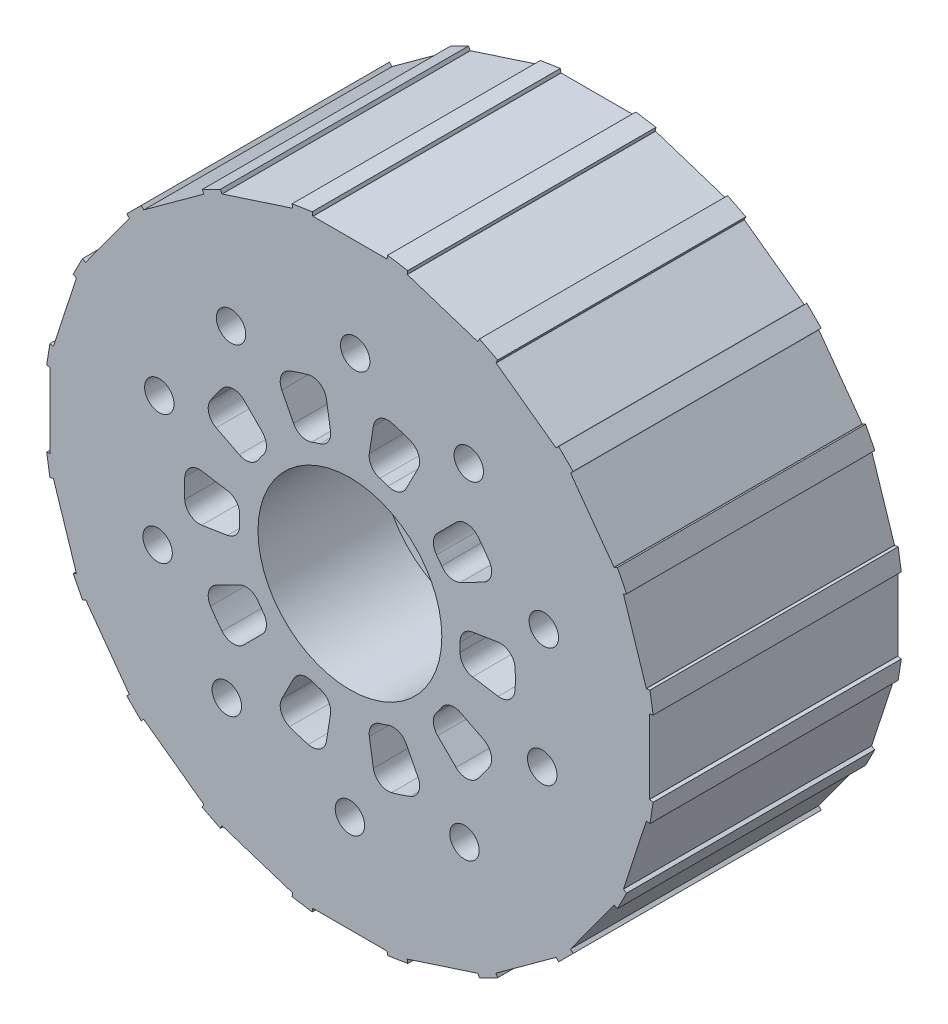
from build123d import *

# Parameters (mm, degrees)
SKETCH1_R           = 25
BOSS_EXTRUDE1_DEPTH = 67.5
SKETCH2_R           = 68
CUT_EXTRUDE1_DEPTH  = 33.75
SKETCH3_R           = 4
CUT_EXTRUDE2_DEPTH  = 33.75
CUT_EXTRUDE3_DEPTH  = 33.75
SKETCH5_R           = 4
CUT_EXTRUDE4_DEPTH  = 122.418033578


with BuildPart() as part:
    # Sketch1 → Boss-Extrude1 (new body)
    with BuildSketch(Plane.XY):
        Polygon((10, 81.5), (-10, 81.5), (-10.098768834, 81.484356553), (-10.255203299, 82.472044894), (-15.73198551, 81.604607809), (-15.575551045, 80.616919468), (-15.674319879, 80.601276022), (-34.695450205, 74.420936134), (-34.784550857, 74.375537084), (-35.238541357, 75.266543609), (-40.179217965, 72.749143139), (-39.725227466, 71.858136614), (-39.814328118, 71.812737564), (-55.994668006, 60.057032519), (-56.065378684, 59.986321841), (-56.772485465, 60.693428622), (-60.693428622, 56.772485465), (-59.986321841, 56.065378684), (-60.057032519, 55.994668006), (-71.812737564, 39.814328118), (-71.858136614, 39.725227466), (-72.749143139, 40.179217965), (-75.266543609, 35.238541357), (-74.375537084, 34.784550857), (-74.420936134, 34.695450205), (-80.601276022, 15.674319879), (-80.616919468, 15.575551045), (-81.604607809, 15.73198551), (-82.472044894, 10.255203299), (-81.484356553, 10.098768834), (-81.5, 10), (-81.5, -10), (-81.484356553, -10.098768834), (-82.472044894, -10.255203299), (-81.604607809, -15.73198551), (-80.616919468, -15.575551045), (-80.601276022, -15.674319879), (-74.420936134, -34.695450205), (-74.375537084, -34.784550857), (-75.266543609, -35.238541357), (-72.749143139, -40.179217965), (-71.858136614, -39.725227466), (-71.812737564, -39.814328118), (-60.057032519, -55.994668006), (-59.986321841, -56.065378684), (-60.693428622, -56.772485465), (-56.772485465, -60.693428622), (-56.065378684, -59.986321841), (-55.994668006, -60.057032519), (-39.814328118, -71.812737564), (-39.725227466, -71.858136614), (-40.179217965, -72.749143139), (-35.238541357, -75.266543609), (-34.784550857, -74.375537084), (-34.695450205, -74.420936134), (-15.674319879, -80.601276022), (-15.575551045, -80.616919468), (-15.73198551, -81.604607809), (-10.255203299, -82.472044894), (-10.098768834, -81.484356553), (-10, -81.5), (10, -81.5), (10.098768834, -81.484356553), (10.255203299, -82.472044894), (15.73198551, -81.604607809), (15.575551045, -80.616919468), (15.674319879, -80.601276022), (34.695450205, -74.420936134), (34.784550857, -74.375537084), (35.238541357, -75.266543609), (40.179217965, -72.749143139), (39.725227466, -71.858136614), (39.814328118, -71.812737564), (55.994668006, -60.057032519), (56.065378684, -59.986321841), (56.772485465, -60.693428622), (60.693428622, -56.772485465), (59.986321841, -56.065378684), (60.057032519, -55.994668006), (71.812737564, -39.814328118), (71.858136614, -39.725227466), (72.749143139, -40.179217965), (75.266543609, -35.238541357), (74.375537084, -34.784550857), (74.420936134, -34.695450205), (80.601276022, -15.674319879), (80.616919468, -15.575551045), (81.604607809, -15.73198551), (82.472044894, -10.255203299), (81.484356554, -10.098768834), (81.5, -10), (81.5, 10), (81.484356553, 10.098768834), (82.472044894, 10.255203299), (81.604607809, 15.73198551), (80.616919468, 15.575551045), (80.601276022, 15.674319879), (74.420936134, 34.695450205), (74.375537084, 34.784550857), (75.266543609, 35.238541357), (72.749143139, 40.179217965), (71.858136614, 39.725227466), (71.812737564, 39.814328118), (60.057032519, 55.994668006), (59.986321841, 56.065378684), (60.693428622, 56.772485465), (56.772485465, 60.693428622), (56.065378684, 59.986321841), (55.994668006, 60.057032519), (39.814328118, 71.812737564), (39.725227466, 71.858136614), (40.179217965, 72.749143139), (35.238541357, 75.266543609), (34.784550857, 74.375537084), (34.695450205, 74.420936134), (15.674319879, 80.601276022), (15.575551045, 80.616919468), (15.73198551, 81.604607809), (10.255203299, 82.472044894), (10.098768834, 81.484356553), align=None)
        Circle(SKETCH1_R, mode=Mode.SUBTRACT)
    extrude(amount=BOSS_EXTRUDE1_DEPTH)

    # Sketch2 → Cut-Extrude1 (cut)
    with BuildSketch(Plane(origin=(0, 0, 0), x_dir=(-1, 0, 0), z_dir=(0, 0, -1))):
        Circle(SKETCH2_R)
    extrude(amount=-CUT_EXTRUDE1_DEPTH, mode=Mode.SUBTRACT)

    # Sketch3 → Cut-Extrude2 (cut)
    with BuildSketch(Plane(origin=(0, 0, 33.75), x_dir=(-1, 0, 0), z_dir=(0, 0, -1))):
        with Locations((32.328188876, 44.495934691)):
            Circle(SKETCH3_R)
        with Locations((52.308108396, -16.995934691)):
            Circle(SKETCH3_R)
        with Locations((0, -55)):
            Circle(SKETCH3_R)
        with Locations((-52.308108396, -16.995934691)):
            Circle(SKETCH3_R)
        with Locations((-32.328188876, 44.495934691)):
            Circle(SKETCH3_R)
    extrude(amount=-CUT_EXTRUDE2_DEPTH, mode=Mode.SUBTRACT)

    # Sketch4 → Cut-Extrude3 (cut)
    with BuildSketch(Plane(origin=(0, 0, 33.75), x_dir=(-1, 0, 0), z_dir=(0, 0, -1))):
        with BuildLine():
            Line((-5.281835449, 33.348196567), (-6.383216288, 40.302041509))
            ThreePointArc((-6.383216288, 40.302041509), (-8.14367989, 43.023336778), (-11.342161812, 43.547162542))
            ThreePointArc((-11.342161812, 43.547162542), (-13.905764747, 42.797543233), (-16.420378262, 41.897149995))
            ThreePointArc((-16.420378262, 41.897149995), (-18.700107434, 39.593345547), (-18.52481518, 36.356996886))
            Line((-18.52481518, 36.356996886), (-15.328483493, 30.083842737))
            ThreePointArc((-15.328483493, 30.083842737), (-13.222545057, 28.175025497), (-10.380403585, 28.146886531))
            ThreePointArc((-10.380403585, 28.146886531), (-9.270509831, 28.531695489), (-8.146401893, 28.872757683))
            ThreePointArc((-8.146401893, 28.872757683), (-5.86360081, 30.566091427), (-5.281835449, 33.348196567))
        make_face()
        with BuildLine():
            Line((15.328483493, 30.083842737), (18.52481518, 36.356996886))
            ThreePointArc((18.52481518, 36.356996886), (18.700107434, 39.593345547), (16.420378262, 41.897149995))
            ThreePointArc((16.420378262, 41.897149995), (13.905764747, 42.797543233), (11.342161812, 43.547162542))
            ThreePointArc((11.342161812, 43.547162542), (8.14367989, 43.023336778), (6.383216288, 40.302041509))
            Line((6.383216288, 40.302041509), (5.281835449, 33.348196567))
            ThreePointArc((5.281835449, 33.348196567), (5.86360081, 30.566091427), (8.146401893, 28.872757683))
            ThreePointArc((8.146401893, 28.872757683), (9.270509831, 28.531695489), (10.380403585, 28.146886531))
            ThreePointArc((10.380403585, 28.146886531), (13.222545057, 28.175025497), (15.328483493, 30.083842737))
        make_face()
        with BuildLine():
            Line((30.083842737, 15.328483493), (36.356996886, 18.52481518))
            ThreePointArc((36.356996886, 18.52481518), (38.401089313, 21.040042045), (37.910891949, 24.243850182))
            ThreePointArc((37.910891949, 24.243850182), (36.405764747, 26.450336353), (34.77238158, 28.563639111))
            ThreePointArc((34.77238158, 28.563639111), (31.87685829, 30.019875669), (28.853076093, 28.853076093))
            Line((28.853076093, 28.853076093), (23.874672773, 23.874672773))
            ThreePointArc((23.874672773, 23.874672773), (22.710050465, 21.281949334), (23.561558733, 18.570216748))
            ThreePointArc((23.561558733, 18.570216748), (24.270509831, 17.633557569), (24.94224771, 16.669861403))
            ThreePointArc((24.94224771, 16.669861403), (27.25812813, 15.022057462), (30.083842737, 15.328483493))
        make_face()
        with BuildLine():
            Line((33.348196567, -5.281835449), (40.302041509, -6.383216288))
            ThreePointArc((40.302041509, -6.383216288), (43.434160278, -5.549842393), (44.920733454, -2.669776382))
            ThreePointArc((44.920733454, -2.669776382), (45, 0), (44.920733454, 2.669776382))
            ThreePointArc((44.920733454, 2.669776382), (43.434160278, 5.549842393), (40.302041509, 6.383216288))
            Line((40.302041509, 6.383216288), (33.348196567, 5.281835449))
            ThreePointArc((33.348196567, 5.281835449), (30.882032728, 3.868825943), (29.977000965, 1.174484194))
            ThreePointArc((29.977000965, 1.174484194), (30, 0), (29.977000965, -1.174484194))
            ThreePointArc((29.977000965, -1.174484194), (30.882032728, -3.868825943), (33.348196567, -5.281835449))
        make_face()
        with BuildLine():
            Line((23.874672773, -23.874672773), (28.853076093, -28.853076093))
            ThreePointArc((28.853076093, -28.853076093), (31.87685829, -30.019875669), (34.77238158, -28.563639111))
            ThreePointArc((34.77238158, -28.563639111), (36.405764747, -26.450336353), (37.910891949, -24.243850182))
            ThreePointArc((37.910891949, -24.243850182), (38.401089313, -21.040042045), (36.356996886, -18.52481518))
            Line((36.356996886, -18.52481518), (30.083842737, -15.328483493))
            ThreePointArc((30.083842737, -15.328483493), (27.25812813, -15.022057462), (24.94224771, -16.669861403))
            ThreePointArc((24.94224771, -16.669861403), (24.270509831, -17.633557569), (23.561558733, -18.570216748))
            ThreePointArc((23.561558733, -18.570216748), (22.710050465, -21.281949334), (23.874672773, -23.874672773))
        make_face()
        with BuildLine():
            Line((5.281835449, -33.348196567), (6.383216288, -40.302041509))
            ThreePointArc((6.383216288, -40.302041509), (8.14367989, -43.023336778), (11.342161812, -43.547162542))
            ThreePointArc((11.342161812, -43.547162542), (13.905764747, -42.797543233), (16.420378262, -41.897149995))
            ThreePointArc((16.420378262, -41.897149995), (18.700107434, -39.593345547), (18.52481518, -36.356996886))
            Line((18.52481518, -36.356996886), (15.328483493, -30.083842737))
            ThreePointArc((15.328483493, -30.083842737), (13.222545057, -28.175025497), (10.380403585, -28.146886531))
            ThreePointArc((10.380403585, -28.146886531), (9.270509831, -28.531695489), (8.146401893, -28.872757683))
            ThreePointArc((8.146401893, -28.872757683), (5.86360081, -30.566091427), (5.281835449, -33.348196567))
        make_face()
        with BuildLine():
            Line((-15.328483493, -30.083842737), (-18.52481518, -36.356996886))
            ThreePointArc((-18.52481518, -36.356996886), (-18.700107434, -39.593345547), (-16.420378262, -41.897149995))
            ThreePointArc((-16.420378262, -41.897149995), (-13.905764747, -42.797543233), (-11.342161812, -43.547162542))
            ThreePointArc((-11.342161812, -43.547162542), (-8.14367989, -43.023336778), (-6.383216288, -40.302041509))
            Line((-6.383216288, -40.302041509), (-5.281835449, -33.348196567))
            ThreePointArc((-5.281835449, -33.348196567), (-5.86360081, -30.566091427), (-8.146401893, -28.872757683))
            ThreePointArc((-8.146401893, -28.872757683), (-9.270509831, -28.531695489), (-10.380403585, -28.146886531))
            ThreePointArc((-10.380403585, -28.146886531), (-13.222545057, -28.175025497), (-15.328483493, -30.083842737))
        make_face()
        with BuildLine():
            Line((-30.083842737, 15.328483493), (-36.356996886, 18.52481518))
            ThreePointArc((-36.356996886, 18.52481518), (-38.401089313, 21.040042045), (-37.910891949, 24.243850182))
            ThreePointArc((-37.910891949, 24.243850182), (-36.405764747, 26.450336353), (-34.77238158, 28.563639111))
            ThreePointArc((-34.77238158, 28.563639111), (-31.87685829, 30.019875669), (-28.853076093, 28.853076093))
            Line((-28.853076093, 28.853076093), (-23.874672773, 23.874672773))
            ThreePointArc((-23.874672773, 23.874672773), (-22.710050465, 21.281949334), (-23.561558733, 18.570216748))
            ThreePointArc((-23.561558733, 18.570216748), (-24.270509831, 17.633557569), (-24.94224771, 16.669861403))
            ThreePointArc((-24.94224771, 16.669861403), (-27.25812813, 15.022057462), (-30.083842737, 15.328483493))
        make_face()
        with BuildLine():
            Line((-30.083842737, -15.328483493), (-36.356996886, -18.52481518))
            ThreePointArc((-36.356996886, -18.52481518), (-38.401089313, -21.040042045), (-37.910891949, -24.243850182))
            ThreePointArc((-37.910891949, -24.243850182), (-36.405764747, -26.450336353), (-34.77238158, -28.563639111))
            ThreePointArc((-34.77238158, -28.563639111), (-31.87685829, -30.019875669), (-28.853076093, -28.853076093))
            Line((-28.853076093, -28.853076093), (-23.874672773, -23.874672773))
            ThreePointArc((-23.874672773, -23.874672773), (-22.710050465, -21.281949334), (-23.561558733, -18.570216748))
            ThreePointArc((-23.561558733, -18.570216748), (-24.270509831, -17.633557569), (-24.94224771, -16.669861403))
            ThreePointArc((-24.94224771, -16.669861403), (-27.25812813, -15.022057462), (-30.083842737, -15.328483493))
        make_face()
        with BuildLine():
            Line((-33.348196567, 5.281835449), (-40.302041509, 6.383216288))
            ThreePointArc((-40.302041509, 6.383216288), (-43.434160278, 5.549842393), (-44.920733454, 2.669776382))
            ThreePointArc((-44.920733454, 2.669776382), (-45, 0), (-44.920733454, -2.669776382))
            ThreePointArc((-44.920733454, -2.669776382), (-43.434160278, -5.549842393), (-40.302041509, -6.383216288))
            Line((-40.302041509, -6.383216288), (-33.348196567, -5.281835449))
            ThreePointArc((-33.348196567, -5.281835449), (-30.882032728, -3.868825943), (-29.977000965, -1.174484194))
            ThreePointArc((-29.977000965, -1.174484194), (-30, 0), (-29.977000965, 1.174484194))
            ThreePointArc((-29.977000965, 1.174484194), (-30.882032728, 3.868825943), (-33.348196567, 5.281835449))
        make_face()
    extrude(amount=-CUT_EXTRUDE3_DEPTH, mode=Mode.SUBTRACT)

    # Sketch5 → Cut-Extrude4 (cut, through all)
    with BuildSketch(Plane(origin=(0, 0, 33.75), x_dir=(-1, 0, 0), z_dir=(0, 0, -1))):
        with Locations((-1.439732157, 54.981152874)):
            Circle(SKETCH5_R)
        with Locations((51.84528201, 18.359377258)):
            Circle(SKETCH5_R)
        with Locations((33.481878595, -43.634433716)):
            Circle(SKETCH5_R)
        with Locations((-31.152343031, -45.326940374)):
            Circle(SKETCH5_R)
        with Locations((-52.735085418, 15.620843959)):
            Circle(SKETCH5_R)
    extrude(amount=-CUT_EXTRUDE4_DEPTH, mode=Mode.SUBTRACT)


solid = part.part
